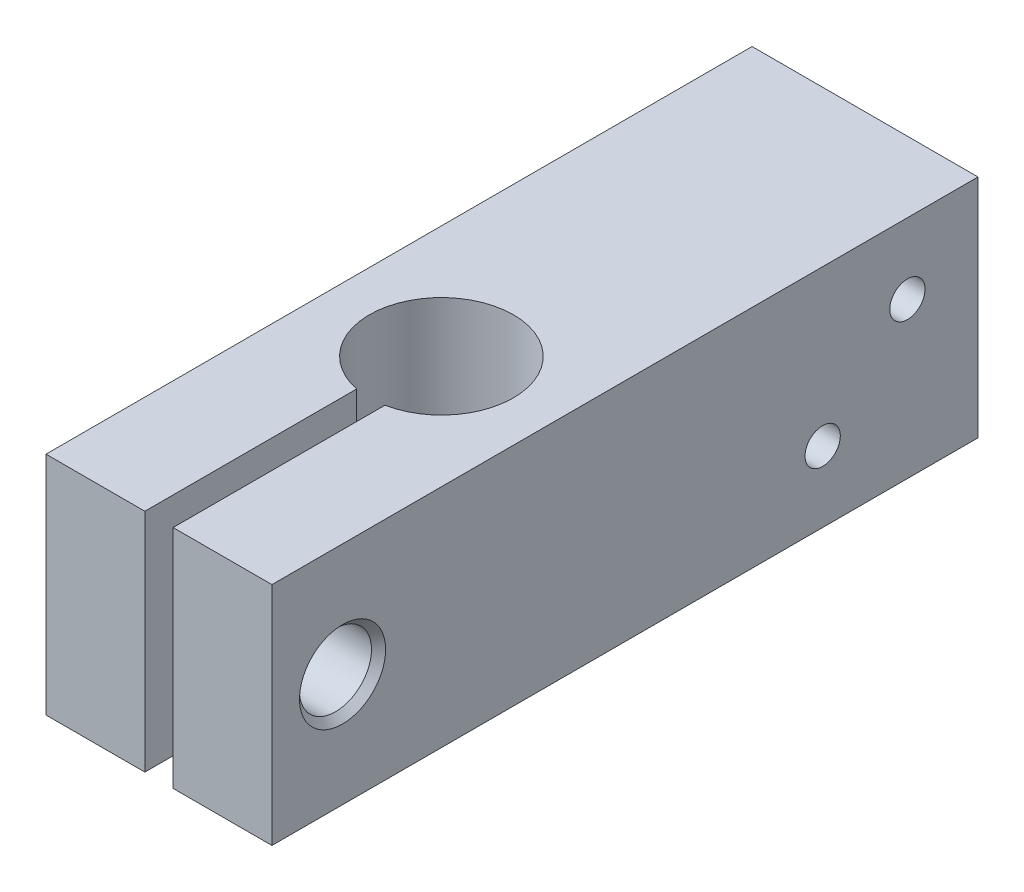
from build123d import *

# Parameters (mm, degrees)
SKETCH1_W                                 = 16
SKETCH1_H                                 = 16
BASE_DEPTH                                = 50
SKETCH2_W                                 = 2
SKETCH2_H                                 = 16
RODSLOT_DEPTH                             = 54.103672189
F_5_1_5_1_FREE_HOLE_FOR_SCREW_D           = 5.1
F_5_1_5_1_FREE_HOLE_FOR_SCREW_DEPTH       = 7.5
F_5_1_5_1_FREE_HOLE_FOR_SCREW_CSINK_D     = 6.1
F_5_1_5_1_FREE_HOLE_FOR_SCREW_CSINK_ANGLE = 90
F_5_1_5_1_FREE_HOLE_FOR_SCREW_TIP         = 1.056244584
M5X0_8_TAPPED_HOLE_FOR_ROD_SCREW_D        = 4.2
M5X0_8_TAPPED_HOLE_FOR_ROD_SCREW_DEPTH    = 7.6381927
M5X0_8_TAPPED_HOLE_FOR_ROD_SCREW_TIP      = 1.2618073
F_3_1_3_1_SCREW_HOLES_D                   = 2.5
F_10_2_10_2_ROD_HOLE_D                    = 10.2


with BuildPart() as part:
    # Sketch1 → Base (new body)
    with BuildSketch(Plane.XY):
        Rectangle(SKETCH1_W, SKETCH1_H)
    extrude(amount=BASE_DEPTH)

    # Sketch2 → RodSlot (cut, through all)
    with BuildSketch(Plane(origin=(0, 8, 0), x_dir=(1, 0, 0), z_dir=(0, 1, 0))):
        with Locations((0, -42)):
            Rectangle(SKETCH2_W, SKETCH2_H)
    extrude(amount=-RODSLOT_DEPTH, mode=Mode.SUBTRACT)

    # Ø5.1 (5.1) free hole for screw
    with Locations(Plane(origin=(8, 0, 0), x_dir=(0, 0, -1), z_dir=(1, 0, 0))):
        with Locations((-45, 0)):
            CounterSinkHole(F_5_1_5_1_FREE_HOLE_FOR_SCREW_D / 2, F_5_1_5_1_FREE_HOLE_FOR_SCREW_CSINK_D / 2, depth=F_5_1_5_1_FREE_HOLE_FOR_SCREW_DEPTH, counter_sink_angle=F_5_1_5_1_FREE_HOLE_FOR_SCREW_CSINK_ANGLE)
            with Locations((0, 0, -(F_5_1_5_1_FREE_HOLE_FOR_SCREW_DEPTH + F_5_1_5_1_FREE_HOLE_FOR_SCREW_TIP / 2))):  # 135° drill point
                Cone(0, F_5_1_5_1_FREE_HOLE_FOR_SCREW_D / 2, F_5_1_5_1_FREE_HOLE_FOR_SCREW_TIP, mode=Mode.SUBTRACT)

    # M5x0.8 Tapped Hole for rod screw
    with Locations(Plane.ZY.offset(8)):
        with Locations((45, 0)):
            Hole(M5X0_8_TAPPED_HOLE_FOR_ROD_SCREW_D / 2, depth=M5X0_8_TAPPED_HOLE_FOR_ROD_SCREW_DEPTH)
            with Locations((0, 0, -(M5X0_8_TAPPED_HOLE_FOR_ROD_SCREW_DEPTH + M5X0_8_TAPPED_HOLE_FOR_ROD_SCREW_TIP / 2))):  # 118° drill point
                Cone(0, M5X0_8_TAPPED_HOLE_FOR_ROD_SCREW_D / 2, M5X0_8_TAPPED_HOLE_FOR_ROD_SCREW_TIP, mode=Mode.SUBTRACT)

    # Ø3.1 (3.1) screw holes (through all)
    with Locations(Plane.YZ.offset(8)):
        with Locations((3, 5), (-3, 11)):
            Hole(F_3_1_3_1_SCREW_HOLES_D / 2)

    # Ø10.2 (10.2) Rod Hole (through all)
    with Locations(Plane(origin=(0, 8, 0), x_dir=(1, 0, 0), z_dir=(0, 1, 0))):
        with Locations((0, -30)):
            Hole(F_10_2_10_2_ROD_HOLE_D / 2)


solid = part.part
